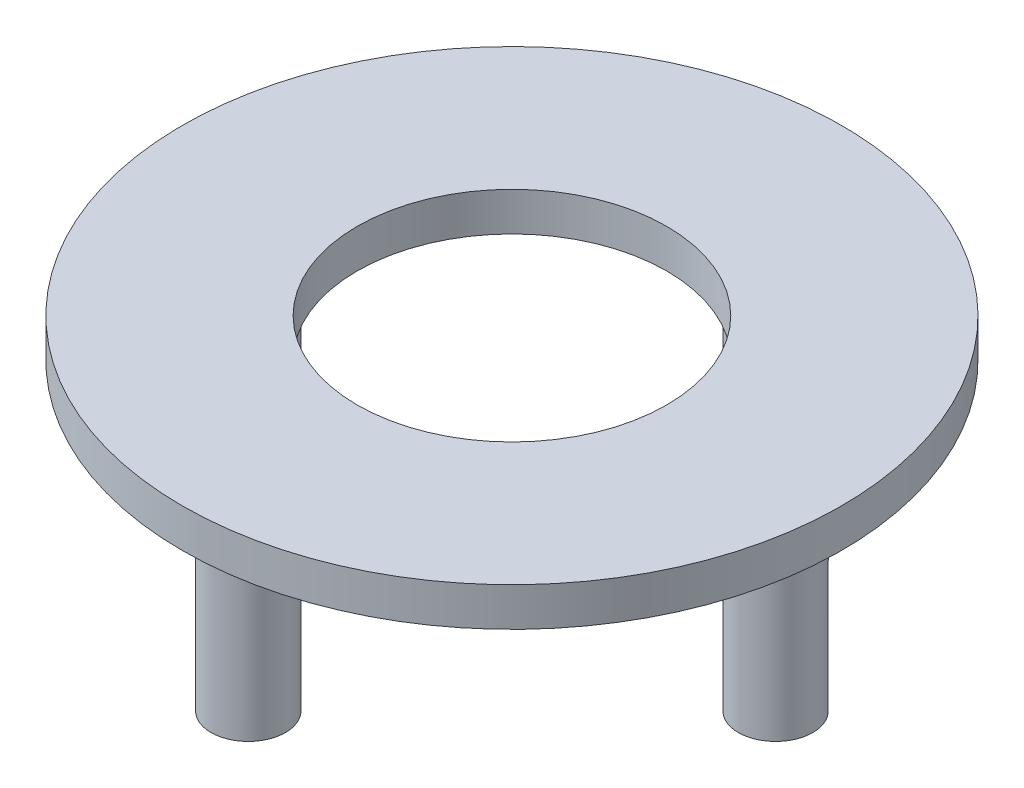
from build123d import *

# Parameters (mm, degrees)
SKETCH_1_R      = 57.5
SKETCH_1_R_2    = 27
EXTRUDE_2_DEPTH = 6.75
SKETCH_3_R      = 6.5
EXTRUDE_3_DEPTH = 30


with BuildPart() as part:
    # 草圖1 → 填料-伸長2 (new body)
    with BuildSketch(Plane(origin=(0, 0, 0), x_dir=(1, 0, 0), z_dir=(0, 1, 0))):
        with Locations(Location((0, 0, 0), (0, 0, 270))):
            Circle(SKETCH_1_R)
        with Locations(Location((0, 0, 0), (0, 0, 270))):
            Circle(SKETCH_1_R_2, mode=Mode.SUBTRACT)
    extrude(amount=EXTRUDE_2_DEPTH)

    # 草圖3 → 填料-伸長3 (add)
    with BuildSketch(Plane.XZ):
        with Locations(Location((0, 46, 0), (0, 0, 90))):
            Circle(SKETCH_3_R)
        with Locations(Location((0, -46, 0), (0, 0, 90))):
            Circle(SKETCH_3_R)
        with Locations(Location((-46, 0, 0), (0, 0, 90))):
            Circle(SKETCH_3_R)
        with Locations(Location((46, 0, 0), (0, 0, 90))):
            Circle(SKETCH_3_R)
    extrude(amount=EXTRUDE_3_DEPTH)


solid = part.part
